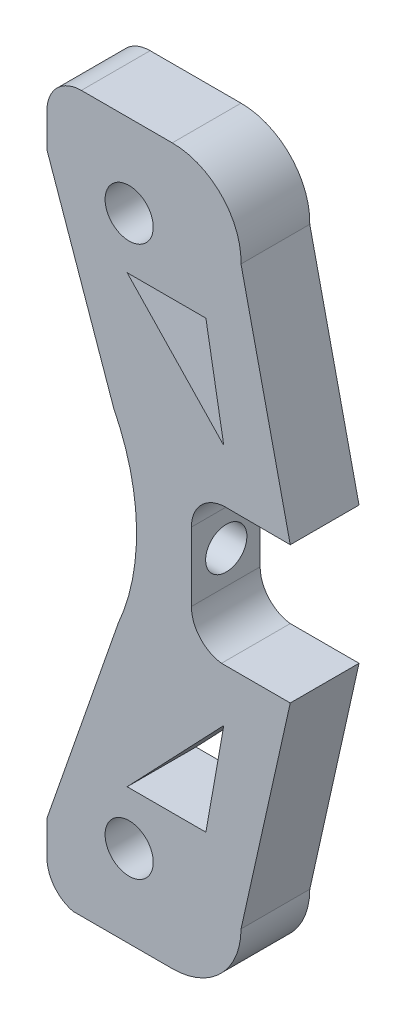
from build123d import *

# Parameters (mm, degrees)
ESBO_O1_R                = 3.5
RESSALTO_EXTRUS_O1_DEPTH = 10
ESBO_O2_R                = 3
CORTE_EXTRUS_O1_DEPTH    = 10


with BuildPart() as part:
    # Esboço1 → Ressalto-extrusão1 (new body)
    with BuildSketch(Plane.XY):
        with BuildLine():
            Line((16.477791125, 11.172502957), (9.316356929, 42.949783159))
            ThreePointArc((9.316356929, 42.949783159), (6.482723548, 50.189321152), (-0.680221872, 53.211340576))
            Line((-0.680221872, 53.211340576), (-13.900221872, 53.211340576))
            ThreePointArc((-13.900221872, 53.211340576), (-17.435755778, 51.746874482), (-18.900221872, 48.211340576))
            Line((-18.900221872, 48.211340576), (-18.900221872, 43.211340576))
            Line((-18.900221872, 43.211340576), (-9.19947784, 15.541635731))
            ThreePointArc((-9.19947784, 15.541635731), (-5.879873215, 2.214686326), (-8.553040247, -11.256821879))
            Line((-8.553040247, -11.256821879), (-18.900221872, -40.946499789))
            Line((-18.900221872, -40.946499789), (-18.900221872, -45.946499789))
            ThreePointArc((-18.900221872, -45.946499789), (-17.851927459, -49.009835055), (-15.146612691, -50.788659424))
            Line((-15.146612691, -50.788659424), (-13.900221872, -50.788659424))
            Line((-13.900221872, -50.788659424), (-0.680221872, -50.788659424))
            ThreePointArc((-0.680221872, -50.788659424), (6.39084594, -47.859727235), (9.319778128, -40.788659424))
            Line((9.319778128, -40.788659424), (16.477791125, -8.749821804))
            Line((16.477791125, -8.749821804), (6.477791125, -8.749821804))
            ThreePointArc((6.477791125, -8.749821804), (3.350782595, -7.096987172), (2.099778128, -3.788659424))
            Line((2.099778128, -3.788659424), (2.099778128, 6.209261385))
            ThreePointArc((2.099778128, 6.209261385), (3.564118149, 9.745530472), (7.099778128, 11.211340576))
            Line((7.099778128, 11.211340576), (16.477791125, 11.172502957))
        make_face()
        with Locations((-6.950221872, 41.211340576)):
            Circle(ESBO_O1_R, mode=Mode.SUBTRACT)
        with Locations(Location((-6.950221872, -38.788659424, 0), (0, 0, 180))):
            Circle(ESBO_O1_R, mode=Mode.SUBTRACT)
        Polygon((-7.240418913, 33.581340576), (4.209581087, 33.581340576), (6.808835229, 18.845396153), align=None, mode=Mode.SUBTRACT)
        Polygon((4.209581087, -31.158659424), (6.808835229, -16.422715), (-7.240418913, -31.158659424), align=None, mode=Mode.SUBTRACT)
    extrude(amount=RESSALTO_EXTRUS_O1_DEPTH)

    # Esboço2 → Corte-extrusão1 (cut)
    with BuildSketch(Plane(origin=(2.099778128, 0, 0), x_dir=(0, 0, -1), z_dir=(1, 0, 0))):
        with Locations(Location((-4.928277881, 1.02125064, 0), (0, 0, 90))):
            Circle(ESBO_O2_R)
    extrude(amount=-CORTE_EXTRUS_O1_DEPTH, mode=Mode.SUBTRACT)


solid = part.part
